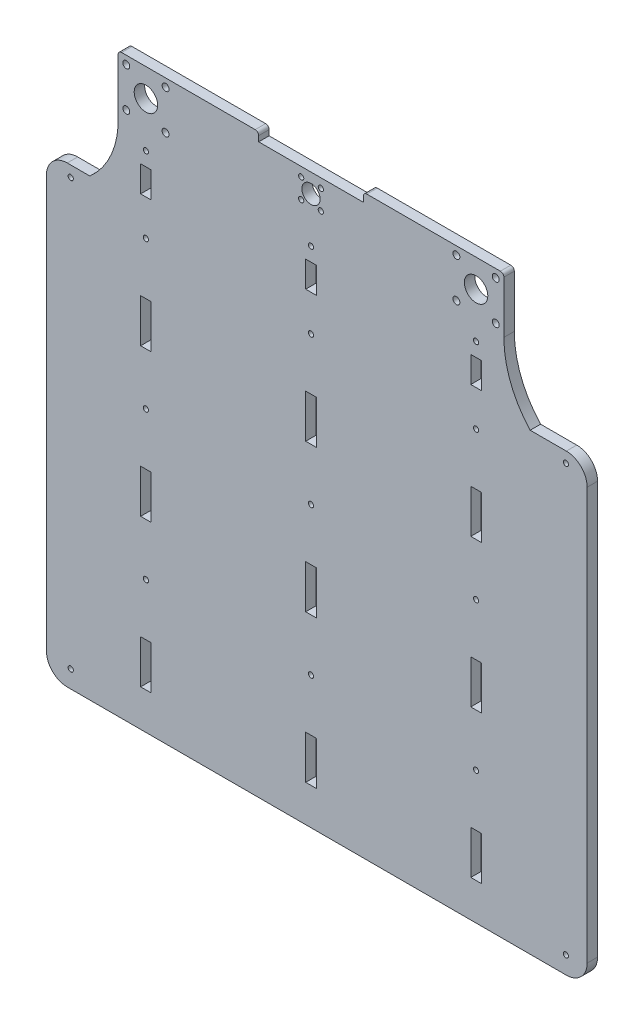
from build123d import *

# Parameters (mm, degrees)
CROQUIS1_R              = 1.5
CROQUIS1_W              = 6.1
CROQUIS1_H              = 25
CROQUIS1_H_2            = 15
CROQUIS1_R_2            = 2
CROQUIS1_R_3            = 6.75
CROQUIS1_R_4            = 5.25
SALIENTE_EXTRUIR1_DEPTH = 6


with BuildPart() as part:
    # Croquis1 → Saliente-Extruir1 (new body)
    with BuildSketch(Plane.XY):
        with BuildLine():
            Line((87.635637669, 16), (32.115377174, 16))
            ThreePointArc((32.115377174, 16), (30.701163612, 15.414213562), (30.115377174, 14))
            Line((30.115377174, 14), (30.115377174, 10.910010016))
            Line((30.115377174, 10.910010016), (-30.115377174, 10.910010016))
            Line((-30.115377174, 10.910010016), (-30.115377174, 14))
            ThreePointArc((-30.115377174, 14), (-30.701163612, 15.414213562), (-32.115377174, 16))
            Line((-32.115377174, 16), (-44.664398505, 16))
            Line((-44.664398505, 16), (-87.635637669, 16))
            Line((-87.635637669, 16), (-109, 16))
            ThreePointArc((-109, 16), (-110.414213562, 15.414213562), (-111, 14))
            Line((-111, 14), (-111, 0))
            Line((-111, 0), (-111, -15.999955929))
            ThreePointArc((-111, -15.999955929), (-114.684754838, -37.224148725), (-127.277573278, -54.701697231))
            Line((-127.277573278, -54.701697231), (-135.277573278, -54.701697231))
            Line((-135.277573278, -54.701697231), (-140.277573278, -54.701697231))
            ThreePointArc((-140.277573278, -54.701697231), (-148.762854653, -58.216415857), (-152.277573278, -66.701697231))
            Line((-152.277573278, -66.701697231), (-152.277573278, -303.912438798))
            ThreePointArc((-152.277573278, -303.912438798), (-148.762854653, -312.397720172), (-140.277573278, -315.912438798))
            Line((-140.277573278, -315.912438798), (-135.277573278, -315.912438798))
            Line((-135.277573278, -315.912438798), (-119.364295205, -315.912438798))
            Line((-119.364295205, -315.912438798), (119.364429455, -315.912438798))
            Line((119.364429455, -315.912438798), (130.295105026, -315.912438798))
            Line((130.295105026, -315.912438798), (146.942872896, -315.912438798))
            ThreePointArc((146.942872896, -315.912438798), (155.42815427, -312.397720172), (158.942872896, -303.912438798))
            Line((158.942872896, -303.912438798), (158.942872896, -70.770984471))
            Line((158.942872896, -70.770984471), (158.942872896, -66.701697231))
            ThreePointArc((158.942872896, -66.701697231), (155.42815427, -58.216415857), (146.942872896, -54.701697231))
            Line((146.942872896, -54.701697231), (126.134028278, -54.701697231))
            ThreePointArc((126.134028278, -54.701697231), (114.918041875, -36.777730062), (111, -15.999955929))
            Line((111, -15.999955929), (111, 14))
            ThreePointArc((111, 14), (110.414213562, 15.414213562), (109, 16))
            Line((109, 16), (87.635637669, 16))
        make_face()
        with Locations((-138.277573278, -305.912438798)):
            Circle(CROQUIS1_R, mode=Mode.SUBTRACT)
        with Locations((-95, -282.201697231)):
            Rectangle(CROQUIS1_W, CROQUIS1_H, mode=Mode.SUBTRACT)
        with Locations((-95, -239.701697231)):
            Circle(CROQUIS1_R, mode=Mode.SUBTRACT)
        Polygon((-3.049885808, -294.789219369), (-3.049896429, -269.789219369), (3.050103571, -269.789216778), (3.050114192, -294.789216778), align=None, mode=Mode.SUBTRACT)
        with Locations((9.0826e-05, -239.789218073)):
            Circle(CROQUIS1_R, mode=Mode.SUBTRACT)
        with Locations((-95, -197.201697231)):
            Rectangle(CROQUIS1_W, CROQUIS1_H, mode=Mode.SUBTRACT)
        with Locations((-95, -154.701697231)):
            Circle(CROQUIS1_R, mode=Mode.SUBTRACT)
        Polygon((-3.049921919, -209.789219369), (-3.04993254, -184.789219369), (3.05006746, -184.789216778), (3.050078081, -209.789216778), align=None, mode=Mode.SUBTRACT)
        with Locations((5.4715e-05, -154.789218073)):
            Circle(CROQUIS1_R, mode=Mode.SUBTRACT)
        Polygon((91.950125201, -294.701658167), (91.95011458, -269.701658167), (98.05011458, -269.701655576), (98.050125201, -294.701655576), align=None, mode=Mode.SUBTRACT)
        with Locations((146.722426722, -305.912438798)):
            Circle(CROQUIS1_R, mode=Mode.SUBTRACT)
        with Locations((95.000101835, -239.701656871)):
            Circle(CROQUIS1_R, mode=Mode.SUBTRACT)
        Polygon((91.95008909, -209.701658167), (91.950078469, -184.701658167), (98.050078469, -184.701655576), (98.05008909, -209.701655576), align=None, mode=Mode.SUBTRACT)
        with Locations((95.000065724, -154.701656871)):
            Circle(CROQUIS1_R, mode=Mode.SUBTRACT)
        with Locations((-95, -112.201697231)):
            Rectangle(CROQUIS1_W, CROQUIS1_H, mode=Mode.SUBTRACT)
        with Locations((-95, -69.701697231)):
            Circle(CROQUIS1_R, mode=Mode.SUBTRACT)
        Polygon((-3.04995803, -124.789219369), (-3.049968651, -99.789219369), (3.050031349, -99.789216778), (3.05004197, -124.789216778), align=None, mode=Mode.SUBTRACT)
        with Locations((1.8603e-05, -69.789218073)):
            Circle(CROQUIS1_R, mode=Mode.SUBTRACT)
        with Locations((-138.277573278, -60.912438798)):
            Circle(CROQUIS1_R, mode=Mode.SUBTRACT)
        with Locations((-95, -41.5)):
            Rectangle(CROQUIS1_W, CROQUIS1_H_2, mode=Mode.SUBTRACT)
        with Locations((-95, -26)):
            Circle(CROQUIS1_R, mode=Mode.SUBTRACT)
        with Locations((-106.313708499, -11.313708499)):
            Circle(CROQUIS1_R_2, mode=Mode.SUBTRACT)
        with Locations((-83.686291501, -11.313708499)):
            Circle(CROQUIS1_R_2, mode=Mode.SUBTRACT)
        with Locations((-95, 0)):
            Circle(CROQUIS1_R_3, mode=Mode.SUBTRACT)
        with Locations((-106.313708499, 11.313708499)):
            Circle(CROQUIS1_R_2, mode=Mode.SUBTRACT)
        with Locations((-83.686291501, 11.313708499)):
            Circle(CROQUIS1_R_2, mode=Mode.SUBTRACT)
        Polygon((-3.049990229, -48.999960936), (-3.049996601, -33.999960936), (3.050003399, -33.999958344), (3.050009771, -48.999958344), align=None, mode=Mode.SUBTRACT)
        with Locations((0.004600085, -25.999981675)):
            Circle(CROQUIS1_R, mode=Mode.SUBTRACT)
        with Locations((-5.656854249, -5.656854249)):
            Circle(CROQUIS1_R, mode=Mode.SUBTRACT)
        Circle(CROQUIS1_R_4, mode=Mode.SUBTRACT)
        with Locations((-5.656854249, 5.656854249)):
            Circle(CROQUIS1_R, mode=Mode.SUBTRACT)
        Polygon((91.950052978, -124.701658167), (91.950042357, -99.701658167), (98.050042357, -99.701655576), (98.050052978, -124.701655576), align=None, mode=Mode.SUBTRACT)
        with Locations((95.000029612, -69.701656871)):
            Circle(CROQUIS1_R, mode=Mode.SUBTRACT)
        with Locations((5.656854249, -5.656854249)):
            Circle(CROQUIS1_R, mode=Mode.SUBTRACT)
        with Locations((5.656854249, 5.656854249)):
            Circle(CROQUIS1_R, mode=Mode.SUBTRACT)
        Polygon((91.950020817, -48.999960936), (91.950014445, -33.999960936), (98.050014445, -33.999958344), (98.050020817, -48.999958344), align=None, mode=Mode.SUBTRACT)
        with Locations((95.000011046, -25.99995964)):
            Circle(CROQUIS1_R, mode=Mode.SUBTRACT)
        with Locations((146.722426722, -60.912438798)):
            Circle(CROQUIS1_R, mode=Mode.SUBTRACT)
        with Locations((83.686291501, -11.313708499)):
            Circle(CROQUIS1_R_2, mode=Mode.SUBTRACT)
        with Locations((106.313708499, -11.313708499)):
            Circle(CROQUIS1_R_2, mode=Mode.SUBTRACT)
        with Locations((95, 0)):
            Circle(CROQUIS1_R_3, mode=Mode.SUBTRACT)
        with Locations((83.686291501, 11.313708499)):
            Circle(CROQUIS1_R_2, mode=Mode.SUBTRACT)
        with Locations((106.313708499, 11.313708499)):
            Circle(CROQUIS1_R_2, mode=Mode.SUBTRACT)
    extrude(amount=SALIENTE_EXTRUIR1_DEPTH)


solid = part.part
